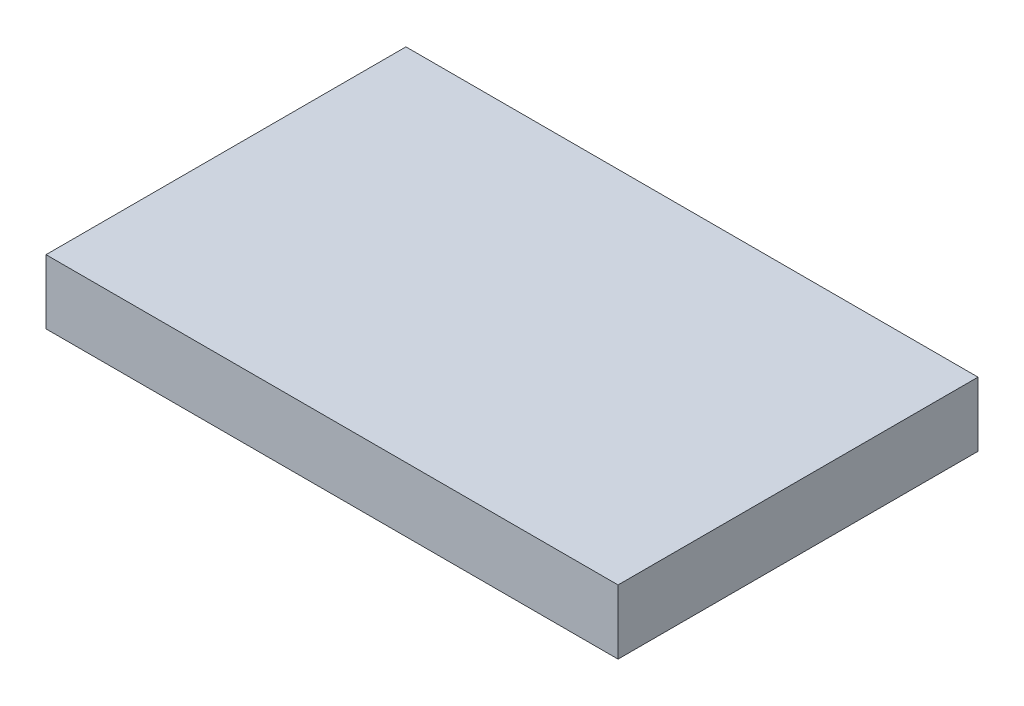
from build123d import *

# Parameters (mm, degrees)
SKETCH1_W           = 89
SKETCH1_H           = 56
BOSS_EXTRUDE1_DEPTH = 5


with BuildPart() as part:
    # Sketch1 → Boss-Extrude1 (new, symmetric)
    with BuildSketch(Plane(origin=(0, 0, 0), x_dir=(1, 0, 0), z_dir=(0, 1, 0))):
        Rectangle(SKETCH1_W, SKETCH1_H)
    extrude(amount=BOSS_EXTRUDE1_DEPTH, both=True)


solid = part.part
